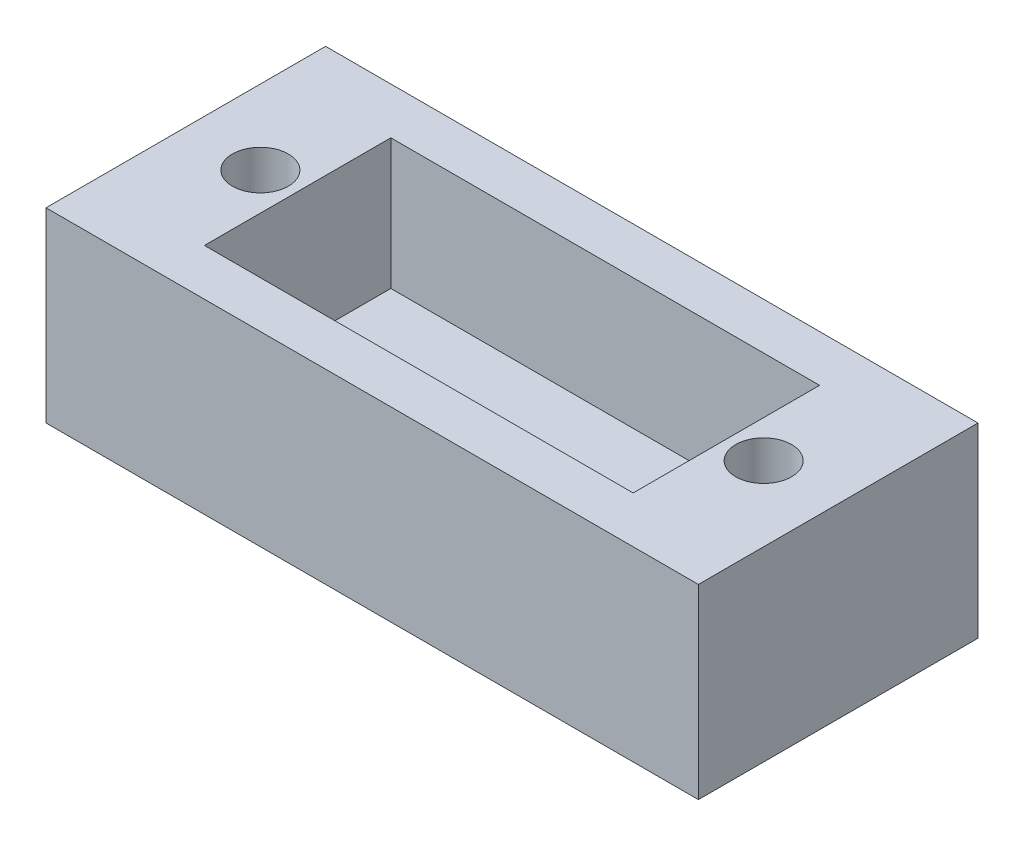
from build123d import *

# Parameters (mm, degrees)
SKETCH_1_W      = 35
SKETCH_1_H      = 15
SKETCH_1_R      = 1.5
SKETCH_1_W_2    = 23
SKETCH_1_H_2    = 10
EXTRUDE_1_DEPTH = 10
SKETCH_1_3_W    = 23
SKETCH_1_3_H    = 10
SKETCH_1_3_W_2  = 20
SKETCH_1_3_H_2  = 4
EXTRUDE_2_DEPTH = 3


with BuildPart() as part:
    # Эскиз1 → Бобышка-Вытянуть1 (new body)
    with BuildSketch(Plane(origin=(0, 0, 0), x_dir=(1, 0, 0), z_dir=(0, 1, 0))):
        Rectangle(SKETCH_1_W, SKETCH_1_H)
        with Locations((-13.5, 0)):
            Circle(SKETCH_1_R, mode=Mode.SUBTRACT)
        Rectangle(SKETCH_1_W_2, SKETCH_1_H_2, mode=Mode.SUBTRACT)
        with Locations((13.5, 0)):
            Circle(SKETCH_1_R, mode=Mode.SUBTRACT)
    extrude(amount=EXTRUDE_1_DEPTH)

    # Эскиз1<3> → Бобышка-Вытянуть2 (add)
    with BuildSketch(Plane(origin=(0, 0, 0), x_dir=(1, 0, 0), z_dir=(0, 1, 0))):
        Rectangle(SKETCH_1_3_W, SKETCH_1_3_H)
        Rectangle(SKETCH_1_3_W_2, SKETCH_1_3_H_2, mode=Mode.SUBTRACT)
    extrude(amount=EXTRUDE_2_DEPTH)


solid = part.part
